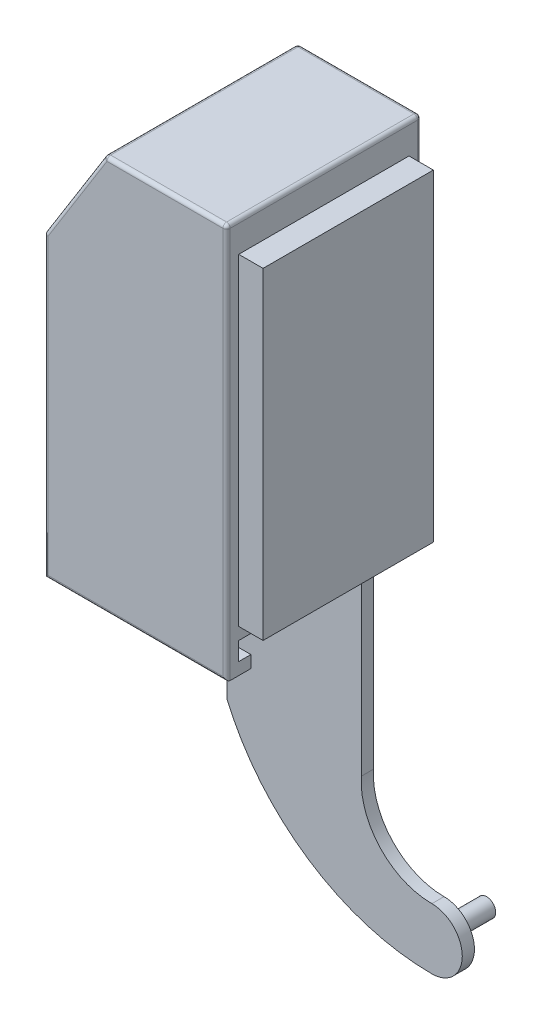
from build123d import *

# Parameters (mm, degrees)
BOSS_EXTRUDE1_DEPTH      = 8
BOSS_EXTRUDE4_DEPTH      = 15
SKETCH3_R                = 2.65
CUT_EXTRUDE1_DEPTH       = 35.481879299
SKETCH5_W                = 14
SKETCH5_H                = 26.5
BOSS_EXTRUDE6_DEPTH      = 2
SKETCH6_R                = 2.5
SKETCH6_R_2              = 0.75
BOSS_EXTRUDE7_DEPTH      = 1
BOSS_EXTRUDE8_DEPTH      = 3.5
BOSS_EXTRUDE8_DEPTH_BACK = 1
SKETCH6_3_R              = 0.75
FILLET1_R                = 0.3


with BuildPart() as part:
    # Sketch1 → Boss-Extrude1 (new, symmetric)
    with BuildSketch(Plane.XY):
        Polygon((7.5, 0), (-7.5, 0), (-7.5, 22), (-2.5, 30), (7.5, 30), align=None)
    extrude(amount=BOSS_EXTRUDE1_DEPTH, both=True)

    # Sketch2 → Boss-Extrude4 (add, through all)
    with BuildSketch(Plane(origin=(7.5, 0, 0), x_dir=(0, 0, -1), z_dir=(1, 0, 0))):
        Polygon((-7, 0), (-8, 0), (-8, -2.5), (-6, -2.5), (-6, -1.5), (-7, -1.5), align=None)
    extrude(amount=-BOSS_EXTRUDE4_DEPTH)

    # Sketch3 → Cut-Extrude1 (cut, through all)
    with BuildSketch(Plane.ZY.offset(7.5)):
        with Locations((0, 14.5)):
            Circle(SKETCH3_R)
        with Locations((0, 6.5)):
            Circle(SKETCH3_R)
    extrude(amount=-CUT_EXTRUDE1_DEPTH, mode=Mode.SUBTRACT)

    # Sketch6 → Boss-Extrude7 (add)
    # profile 1 of 2: a face of its own
    with BuildSketch(Plane(origin=(0, 0, -8), x_dir=(-1, 0, 0), z_dir=(0, 0, -1))):
        with BuildLine():
            ThreePointArc((-9.380331513, -29.798564223), (0.731298937, -26.751572871), (7.475992833, -18.625175706))
            Line((7.475992833, -18.625175706), (7.475992833, 0))
            Line((7.475992833, 0), (-3.577226639, 0))
            Line((-3.577226639, 0), (-3.577226639, -18.625175706))
            ThreePointArc((-3.577226639, -18.625175706), (-5.143978366, -22.966608507), (-9.380331513, -24.798564223))
            ThreePointArc((-9.380331513, -24.798564223), (-7.61256456, -25.53079727), (-6.880331513, -27.298564223))
            ThreePointArc((-6.880331513, -27.298564223), (-7.61256456, -29.066331176), (-9.380331513, -29.798564223))
        make_face()
    # profile 2 of 2: a face of its own
    with BuildSketch(Plane(origin=(0, 0, -8), x_dir=(-1, 0, 0), z_dir=(0, 0, -1))):
        with Locations((-9.380331513, -27.298564223)):
            Circle(SKETCH6_R)
        with Locations((-9.380331513, -27.298564223)):
            Circle(SKETCH6_R_2, mode=Mode.SUBTRACT)
    extrude(amount=-BOSS_EXTRUDE7_DEPTH)

    # Sketch6<3> → Boss-Extrude8 (add, two sides: drawn at the far end of the back side and taken through both)
    with BuildSketch(Plane(origin=(0, 0, -8), x_dir=(-1, 0, 0), z_dir=(0, 0, -1)).offset(-BOSS_EXTRUDE8_DEPTH_BACK)):
        with Locations((-9.380331513, -27.298564223)):
            Circle(SKETCH6_3_R)
    extrude(amount=BOSS_EXTRUDE8_DEPTH + BOSS_EXTRUDE8_DEPTH_BACK)

    # Fillet1
    fillet1_edges = [part.edges().sort_by_distance(p)[0] for p in [
        (0, -2.5, 8),
        (-7.5, 9.75, 8),
        (7.5, 13.75, 8),
        (7.5, 30, 0),
        (2.5, 30, 8),
        (2.5, 30, -8),
        (-2.5, 30, 0),
        (-5, 26, 8),
        (-7.5, 22, 0),
        (-5, 26, -8),
        (-7.5, 11, -8),
        (7.5, 15, -8),
    ]]
    fillet(fillet1_edges, radius=FILLET1_R)


with BuildPart() as body_2:
    # Sketch5 → Boss-Extrude6 (new body)
    with BuildSketch(Plane(origin=(7.5, 0, 0), x_dir=(0, 0, -1), z_dir=(1, 0, 0))):
        with Locations((0, 14.25)):
            Rectangle(SKETCH5_W, SKETCH5_H)
    extrude(amount=BOSS_EXTRUDE6_DEPTH)


solid = Compound([part.part, body_2.part])
